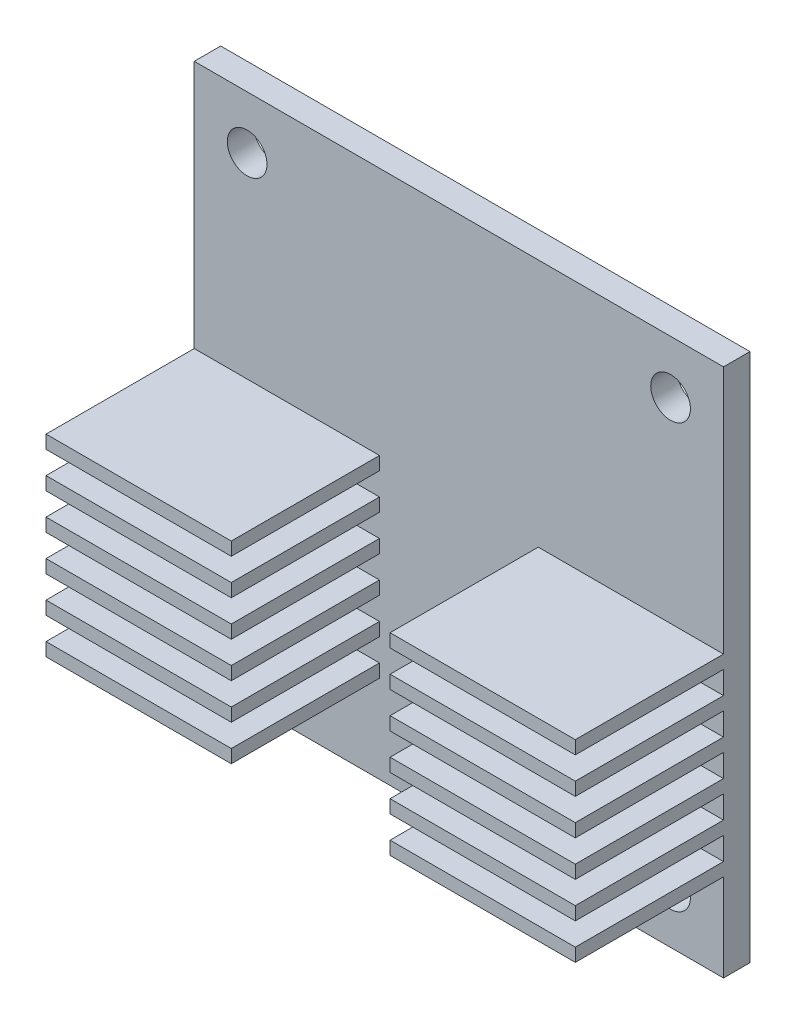
from build123d import *

# Parameters (mm, degrees)
SKETCH1_W            = 40
SKETCH1_H            = 40
BOSS_EXTRUDE1_DEPTH  = 2
EXTRUDE_THIN1_START  = 2
SKETCH1_3_W          = 14
SKETCH1_3_H          = 1
EXTRUDE_THIN1_DEPTH  = 11.2
SKETCH3_R            = 1.5
CUT_EXTRUDE1_DEPTH   = 13.2
LPATTERN1_COUNT      = 2
LPATTERN1_PITCH      = 32
LPATTERN1_COUNT_DIR2 = 2
LPATTERN1_PITCH_DIR2 = 32


with BuildPart() as part:
    # Sketch1 → Boss-Extrude1 (new body)
    with BuildSketch(Plane.XY):
        with Locations((21, 22.483732861)):
            Rectangle(SKETCH1_W, SKETCH1_H)
    extrude(amount=BOSS_EXTRUDE1_DEPTH)

    # Sketch1<3> → Extrude-Thin1 (add)
    with BuildSketch(Plane.XY.offset(EXTRUDE_THIN1_START)):
        with Locations((34, 9.604785493)):
            Rectangle(SKETCH1_3_W, SKETCH1_3_H)
        with Locations((34, 12.320574966)):
            Rectangle(SKETCH1_3_W, SKETCH1_3_H)
        with Locations((34, 15.03636444)):
            Rectangle(SKETCH1_3_W, SKETCH1_3_H)
        with Locations((34, 17.752153914)):
            Rectangle(SKETCH1_3_W, SKETCH1_3_H)
        with Locations((34, 20.467943387)):
            Rectangle(SKETCH1_3_W, SKETCH1_3_H)
        with Locations((34, 23.183732861)):
            Rectangle(SKETCH1_3_W, SKETCH1_3_H)
        with Locations((8, 9.604785493)):
            Rectangle(SKETCH1_3_W, SKETCH1_3_H)
        with Locations((8, 12.320574966)):
            Rectangle(SKETCH1_3_W, SKETCH1_3_H)
        with Locations((8, 15.03636444)):
            Rectangle(SKETCH1_3_W, SKETCH1_3_H)
        with Locations((8, 17.752153914)):
            Rectangle(SKETCH1_3_W, SKETCH1_3_H)
        with Locations((8, 20.467943387)):
            Rectangle(SKETCH1_3_W, SKETCH1_3_H)
        with Locations((8, 23.183732861)):
            Rectangle(SKETCH1_3_W, SKETCH1_3_H)
    extrude(amount=EXTRUDE_THIN1_DEPTH)

    # Sketch3 → Cut-Extrude1 (cut)
    with BuildSketch(Plane(origin=(0, 0, 0), x_dir=(-1, 0, 0), z_dir=(0, 0, -1))):
        with Locations((-37, 6.483732861)):
            Circle(SKETCH3_R)
    cut_extrude1 = extrude(amount=-CUT_EXTRUDE1_DEPTH, mode=Mode.SUBTRACT)

    # LPattern1: Cut-Extrude1 2 × 2
    with Locations(*[(-i * LPATTERN1_PITCH, j * LPATTERN1_PITCH_DIR2, 0) for i in range(LPATTERN1_COUNT) for j in range(LPATTERN1_COUNT_DIR2) if (i, j) != (0, 0)]):
        add(cut_extrude1, mode=Mode.SUBTRACT)


solid = part.part
